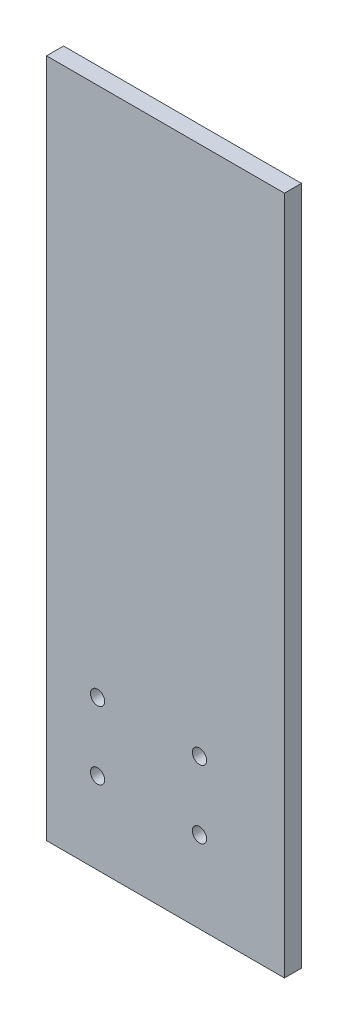
from build123d import *

# Parameters (mm, degrees)
SKETCH_1_W          = 100
SKETCH_1_H          = 200
EXTRUDE_1_DEPTH     = 5
CUT_EXTRUDE_2_DEPTH = 0.001
M4X0_7_HELICOIL_1_D = 4.2
SKETCH_13_W         = 10
SKETCH_13_H         = 200
CUT_EXTRUDE_4_DEPTH = 10
SKETCH_14_W         = 10
SKETCH_14_H         = 200
CUT_EXTRUDE_5_DEPTH = 10


with BuildPart() as part:
    # 스케치1 → 보스-돌출1 (new body)
    with BuildSketch(Plane.XY):
        Rectangle(SKETCH_1_W, SKETCH_1_H)
    extrude(amount=EXTRUDE_1_DEPTH)

    # 스케치3 → 컷-돌출2 (cut)
    # profile 1 of 5: a face of its own
    with BuildSketch(Plane(origin=(0, 0, 0), x_dir=(-1, 0, 0), z_dir=(0, 0, -1))):
        with BuildLine():
            Line((1.435897436, 3.568709936), (1.435897436, 3.241987179))
            add(Edge.make_bspline(
                [(1.435897436, 3.241987179), (1.406158657, 3.253938052), (1.349713836, 3.276621056), (1.26647346, 3.301285681), (1.189944626, 3.317221421), (1.140790736, 3.319457366), (1.117588141, 3.320512821)],
                knots=[0, 0, 0, 0, 1.16548392, 2.212112691, 3.15604595, 4, 4, 4, 4], degree=3))
            add(Edge.make_bspline(
                [(1.117588141, 3.320512821), (1.101914377, 3.31986148), (1.071575198, 3.318600703), (1.027971871, 3.312172427), (0.988682661, 3.299069626), (0.953777041, 3.28204035), (0.924826581, 3.260686166), (0.900040357, 3.239230902), (0.882073827, 3.215045722), (0.872318879, 3.192525311), (0.866368878, 3.171674318), (0.86457875, 3.150320052), (0.860193836, 3.124095966), (0.858971029, 3.091932248), (0.856183661, 3.054829537), (0.856430302, 3.012002641), (0.854146379, 2.964125498), (0.854488293, 2.930224949), (0.854667468, 2.912459936)],
                knots=[0, 0, 0, 0, 1.311993654, 2.539582093, 3.670788641, 4.763509788, 5.772417512, 6.671800701, 7.496729179, 8.266799162, 8.712543678, 9.304149002, 10.05334463, 10.934920737, 11.99209668, 13.165090968, 14.514413552, 16, 16, 16, 16], degree=3))
            Line((0.854667468, 2.912459936), (0.854667468, 2.557692308))
            Line((0.854667468, 2.557692308), (1.391025641, 2.557692308))
            Line((1.391025641, 2.557692308), (1.391025641, 2.243589744))
            Line((1.391025641, 2.243589744), (0.853966346, 2.243589744))
            Line((0.853966346, 2.243589744), (0.852564103, 0))
            Line((0.852564103, 0), (0.538461538, 0))
            Line((0.538461538, 0), (0.538461538, 2.243589744))
            Line((0.538461538, 2.243589744), (0.179487179, 2.243589744))
            Line((0.179487179, 2.243589744), (0.179487179, 2.557692308))
            Line((0.179487179, 2.557692308), (0.538461538, 2.557692308))
            Line((0.538461538, 2.557692308), (0.538461538, 2.966446314))
            add(Edge.make_bspline(
                [(0.538461538, 2.966446314), (0.538486753, 2.989121894), (0.538535124, 3.032622798), (0.541922975, 3.095232239), (0.544818696, 3.153055703), (0.550586323, 3.205644336), (0.557248029, 3.253490479), (0.566784189, 3.29588336), (0.57579556, 3.333965119), (0.592144152, 3.377067776), (0.616566371, 3.4259178), (0.656096568, 3.4775417), (0.703489575, 3.523846647), (0.760097899, 3.562854), (0.823813434, 3.595269478), (0.894694612, 3.618511331), (0.97196981, 3.631651776), (1.02545728, 3.633605985), (1.053084936, 3.634615385)],
                knots=[0, 0, 0, 0, 1.116398763, 2.141702935, 3.087165306, 3.966655413, 4.746276475, 5.464069668, 6.106083417, 6.67047701, 7.730773247, 8.782666744, 9.856985883, 10.980834087, 12.154321827, 13.366232824, 14.639591414, 16, 16, 16, 16], degree=3))
            add(Edge.make_bspline(
                [(1.053084936, 3.634615385), (1.081161694, 3.633658004), (1.140107358, 3.631648034), (1.232303961, 3.619214627), (1.331900478, 3.597743597), (1.400236399, 3.578665712), (1.435897436, 3.568709936)],
                knots=[0, 0, 0, 0, 0.864728408, 1.815451418, 2.859995356, 4, 4, 4, 4], degree=3))
        make_face()
    # profile 2 of 5: a face of its own
    with BuildSketch(Plane(origin=(0, 0, 0), x_dir=(-1, 0, 0), z_dir=(0, 0, -1))):
        with BuildLine():
            Line((1.794871795, 2.557692308), (2.108974359, 2.557692308))
            Line((2.108974359, 2.557692308), (2.108974359, 2.181189904))
            add(Edge.make_bspline(
                [(2.108974359, 2.181189904), (2.132163118, 2.216245732), (2.176511439, 2.283289731), (2.250224368, 2.371959032), (2.325727699, 2.445374079), (2.403382887, 2.503877598), (2.483760987, 2.547690717), (2.565097938, 2.579783752), (2.648673408, 2.598761067), (2.704835332, 2.601294726), (2.732972756, 2.602564103)],
                knots=[0, 0, 0, 0, 1.2804753, 2.448899062, 3.506932113, 4.484331642, 5.4025378, 6.288909075, 7.142734305, 8, 8, 8, 8], degree=3))
            add(Edge.make_bspline(
                [(2.732972756, 2.602564103), (2.754799083, 2.601373576), (2.799708168, 2.59892399), (2.867690758, 2.581713165), (2.93773421, 2.554235143), (2.982876597, 2.52839492), (3.006410256, 2.514923878)],
                knots=[0, 0, 0, 0, 0.901110191, 1.854092781, 2.881294221, 4, 4, 4, 4], degree=3))
            Line((3.006410256, 2.514923878), (2.833934295, 2.242888622))
            add(Edge.make_bspline(
                [(2.833934295, 2.242888622), (2.818825274, 2.249628888), (2.790145459, 2.262423203), (2.748190893, 2.277565213), (2.709509556, 2.286481129), (2.684865998, 2.287831847), (2.673377404, 2.288461538)],
                knots=[0, 0, 0, 0, 1.180555205, 2.24091978, 3.179933427, 4, 4, 4, 4], degree=3))
            add(Edge.make_bspline(
                [(2.673377404, 2.288461538), (2.64817167, 2.286781501), (2.59675928, 2.283354712), (2.521274781, 2.256415904), (2.448027575, 2.212890664), (2.389855913, 2.164619552), (2.34481366, 2.118071755), (2.312673435, 2.077423352), (2.283190688, 2.031844721), (2.255020467, 1.982115037), (2.229354173, 1.927385191), (2.205399504, 1.868201977), (2.183740641, 1.804496849), (2.171390397, 1.760114328), (2.165064103, 1.737379808)],
                knots=[0, 0, 0, 0, 1.125678352, 2.296057538, 3.5422874, 4.923748041, 5.663163013, 6.437101912, 7.23742474, 8.08941207, 8.991984279, 9.93940061, 10.944477711, 12, 12, 12, 12], degree=3))
            add(Edge.make_bspline(
                [(2.165064103, 1.737379808), (2.160331709, 1.717102634), (2.149849818, 1.672190235), (2.13965828, 1.596841711), (2.129588762, 1.507818052), (2.122492143, 1.404871459), (2.115914101, 1.288259015), (2.112204019, 1.15780307), (2.109100878, 1.013369718), (2.109017812, 0.912395365), (2.108974359, 0.859575321)],
                knots=[0, 0, 0, 0, 0.566838948, 1.255505196, 2.06880316, 3.007127437, 4.065329342, 5.249902469, 6.561414163, 8, 8, 8, 8], degree=3))
            Line((2.108974359, 0.859575321), (2.108974359, 0))
            Line((2.108974359, 0), (1.794871795, 0))
            Line((1.794871795, 0), (1.794871795, 2.557692308))
        make_face()
    # profile 3 of 5: a face of its own
    with BuildSketch(Plane(origin=(0, 0, 0), x_dir=(-1, 0, 0), z_dir=(0, 0, -1))):
        with BuildLine():
            add(Edge.make_bspline(
                [(4.555889423, 2.602564103), (4.603880696, 2.601542211), (4.697979853, 2.599538533), (4.835787739, 2.578123567), (4.967332875, 2.545376203), (5.093119067, 2.500104641), (5.211535363, 2.43942269), (5.324306607, 2.367013399), (5.431123616, 2.281230805), (5.495146645, 2.214872737), (5.527644231, 2.181189904)],
                knots=[0, 0, 0, 0, 1.054011418, 2.066658804, 3.057071809, 4.030435133, 4.997543892, 5.974964718, 6.972108034, 8, 8, 8, 8], degree=3))
            add(Edge.make_bspline(
                [(5.527644231, 2.181189904), (5.555626185, 2.148975918), (5.611048565, 2.085171376), (5.682114284, 1.981715763), (5.743335844, 1.874575662), (5.792398805, 1.762328336), (5.831083829, 1.645953664), (5.858549525, 1.525051653), (5.87488646, 1.399889306), (5.877089427, 1.314885468), (5.878205128, 1.271834936)],
                knots=[0, 0, 0, 0, 1.025258237, 2.030674902, 3.01204498, 3.988269485, 4.97094183, 5.956517959, 6.965070386, 8, 8, 8, 8], degree=3))
            add(Edge.make_bspline(
                [(5.878205128, 1.271834936), (5.877223791, 1.228534878), (5.875284623, 1.142971945), (5.856941006, 1.016952579), (5.82840992, 0.894757756), (5.787578082, 0.776899063), (5.735219973, 0.663016235), (5.671329285, 0.553606686), (5.595457668, 0.448454553), (5.509453671, 0.348452714), (5.414401795, 0.2562865), (5.311285647, 0.17595823), (5.202131613, 0.107136706), (5.08548826, 0.05170029), (4.962420773, 0.00799059), (4.832663705, -0.022709427), (4.696418635, -0.04127111), (4.603391413, -0.043654684), (4.555889423, -0.044871795)],
                knots=[0, 0, 0, 0, 0.998656419, 1.973391657, 2.932242238, 3.890759089, 4.846373663, 5.82037756, 6.809684879, 7.83454468, 8.860553229, 9.859544525, 10.845671541, 11.83227036, 12.833544569, 13.85385346, 14.904124723, 16, 16, 16, 16], degree=3))
            add(Edge.make_bspline(
                [(4.555889423, -0.044871795), (4.508154704, -0.043650599), (4.414663844, -0.041258824), (4.277937862, -0.022781541), (4.147948243, 0.007976441), (4.024719644, 0.051843934), (3.907574798, 0.107138478), (3.797788301, 0.175750167), (3.694588385, 0.256310322), (3.599516401, 0.348446259), (3.513517795, 0.448456216), (3.437644787, 0.553606254), (3.373754461, 0.663016348), (3.321396257, 0.776899033), (3.280564444, 0.894757764), (3.252033351, 1.016952577), (3.233689737, 1.142971945), (3.231750568, 1.228534878), (3.230769231, 1.271834936)],
                knots=[0, 0, 0, 0, 1.099876186, 2.154163076, 3.173186993, 4.173200201, 5.163417411, 6.152872554, 7.150605724, 8.17532212, 9.198891216, 10.186952605, 11.159729845, 12.11414092, 13.071450619, 14.029093627, 15.002601286, 16, 16, 16, 16], degree=3))
            add(Edge.make_bspline(
                [(3.230769231, 1.271834936), (3.231892541, 1.314651482), (3.234116503, 1.399420884), (3.250437012, 1.524347945), (3.277795568, 1.645045334), (3.316526965, 1.76097081), (3.366042155, 1.872726246), (3.426403443, 1.980131077), (3.498194076, 2.083118877), (3.553396027, 2.146840957), (3.581330128, 2.179086538)],
                knots=[0, 0, 0, 0, 1.031353054, 2.041901799, 3.029428768, 4.008703097, 4.981709435, 5.96992636, 6.972712378, 8, 8, 8, 8], degree=3))
            add(Edge.make_bspline(
                [(3.581330128, 2.179086538), (3.613778719, 2.213061478), (3.677594583, 2.279879174), (3.784943311, 2.365411698), (3.897437132, 2.439327772), (4.017162058, 2.498803987), (4.142844916, 2.545642505), (4.275064159, 2.57820802), (4.413339674, 2.599461375), (4.507899295, 2.601519553), (4.555889423, 2.602564103)],
                knots=[0, 0, 0, 0, 1.027980169, 2.021703884, 2.998553061, 3.971491411, 4.943284454, 5.930300938, 6.949603206, 8, 8, 8, 8], degree=3))
        make_face()
        with BuildLine():
            add(Edge.make_bspline(
                [(4.554487179, 2.288461538), (4.520549568, 2.287496947), (4.453550439, 2.285592664), (4.354930855, 2.27110876), (4.259990701, 2.248161255), (4.168549857, 2.215557199), (4.080916684, 2.1734583), (3.997007282, 2.12174994), (3.916574842, 2.061116984), (3.841192779, 1.991654312), (3.772010466, 1.915775317), (3.71153249, 1.834926959), (3.660107384, 1.750420612), (3.617267225, 1.662168401), (3.585360036, 1.569275987), (3.562187014, 1.472795356), (3.547716774, 1.37252994), (3.545830395, 1.304368921), (3.544871795, 1.269731571)],
                knots=[0, 0, 0, 0, 1.021534396, 2.016698045, 2.994645724, 3.958388632, 4.93408049, 5.916473867, 6.921342795, 7.962252576, 8.998418191, 10.008913653, 10.997312074, 11.973003931, 12.956656626, 13.948281152, 14.957379055, 16, 16, 16, 16], degree=3))
            add(Edge.make_bspline(
                [(3.544871795, 1.269731571), (3.546478619, 1.224979543), (3.549667863, 1.136155138), (3.575603099, 1.005344015), (3.618989379, 0.879762163), (3.677576659, 0.760145777), (3.750982878, 0.649473499), (3.837469944, 0.550802015), (3.936109645, 0.465616203), (4.045726145, 0.394935358), (4.164080463, 0.338775602), (4.289336784, 0.298976626), (4.419977478, 0.273104934), (4.509258209, 0.270533459), (4.554487179, 0.269230769)],
                knots=[0, 0, 0, 0, 1.016792936, 2.018143844, 3.017858371, 4.030088057, 5.03801393, 6.028138512, 7.003788237, 7.991172063, 8.984598303, 9.972568034, 10.972917682, 12, 12, 12, 12], degree=3))
            add(Edge.make_bspline(
                [(4.554487179, 0.269230769), (4.599713548, 0.270541049), (4.688989144, 0.273127506), (4.819448321, 0.298846326), (4.944362293, 0.338949987), (5.062593681, 0.394872197), (5.172160284, 0.465884611), (5.271509405, 0.550320988), (5.357258017, 0.64973484), (5.430591621, 0.760292369), (5.490138364, 0.879576721), (5.533321566, 1.005367193), (5.559319152, 1.136149235), (5.562499981, 1.224977566), (5.564102564, 1.269731571)],
                knots=[0, 0, 0, 0, 1.02726834, 2.027799167, 3.010890988, 4.004497153, 4.992059811, 5.971914811, 6.958719428, 7.966827853, 8.981595046, 9.981490638, 10.983022906, 12, 12, 12, 12], degree=3))
            add(Edge.make_bspline(
                [(5.564102564, 1.269731571), (5.563144294, 1.304369128), (5.561258565, 1.372530554), (5.546783601, 1.472793007), (5.523628061, 1.569284604), (5.491656444, 1.662136607), (5.44900243, 1.750649112), (5.396585637, 1.834678839), (5.336354611, 1.916055385), (5.26633749, 1.991409026), (5.191034113, 2.061144062), (5.110569074, 2.121773452), (5.026784096, 2.173231047), (4.939405513, 2.215917288), (4.847952945, 2.247864628), (4.753145816, 2.271241259), (4.654947006, 2.285531456), (4.588187963, 2.287478598), (4.554487179, 2.288461538)],
                knots=[0, 0, 0, 0, 1.042956736, 2.052379634, 3.044323526, 4.02829302, 5.004299113, 5.996692471, 7.007513377, 8.048758398, 9.090003419, 10.095195979, 11.07790575, 12.047570684, 13.018257071, 13.989683339, 14.985167495, 16, 16, 16, 16], degree=3))
        make_face(mode=Mode.SUBTRACT)
    # profile 4 of 5: a face of its own
    with BuildSketch(Plane(origin=(0, 0, 0), x_dir=(-1, 0, 0), z_dir=(0, 0, -1))):
        with BuildLine():
            Line((6.506410256, 2.557692308), (6.820512821, 2.557692308))
            Line((6.820512821, 2.557692308), (6.820512821, 2.096354167))
            add(Edge.make_bspline(
                [(6.820512821, 2.096354167), (6.854050456, 2.13819689), (6.919131407, 2.219394153), (7.02751574, 2.326114728), (7.14205964, 2.414059953), (7.262061644, 2.484163747), (7.387684654, 2.537010373), (7.518162924, 2.575176304), (7.65427763, 2.598061132), (7.746842067, 2.601051363), (7.793669872, 2.602564103)],
                knots=[0, 0, 0, 0, 1.12780773, 2.188550248, 3.19190651, 4.159438251, 5.104880172, 6.052711206, 7.014878035, 8, 8, 8, 8], degree=3))
            add(Edge.make_bspline(
                [(7.793669872, 2.602564103), (7.841000506, 2.600818907), (7.933637974, 2.597403139), (8.068516035, 2.570386448), (8.194489429, 2.524241192), (8.311108985, 2.461029122), (8.416236198, 2.382422649), (8.508561049, 2.290844867), (8.584924297, 2.185508784), (8.63612166, 2.087785627), (8.669847307, 2.001096833), (8.691079645, 1.926850083), (8.709110626, 1.844131932), (8.724742374, 1.753192343), (8.735319486, 1.653394153), (8.743661778, 1.545146461), (8.749640472, 1.42848433), (8.749877679, 1.347797703), (8.75, 1.306189904)],
                knots=[0, 0, 0, 0, 1.235846778, 2.418850247, 3.575807741, 4.728682307, 5.871620074, 6.994088408, 8.11269785, 9.256955736, 9.865816715, 10.540099792, 11.271859618, 12.076849838, 12.949306005, 13.892391288, 14.913166135, 16, 16, 16, 16], degree=3))
            Line((8.75, 1.306189904), (8.75, 0))
            Line((8.75, 0), (8.435897436, 0))
            Line((8.435897436, 0), (8.435897436, 1.203125))
            add(Edge.make_bspline(
                [(8.435897436, 1.203125), (8.435704228, 1.237947445), (8.435334654, 1.304556856), (8.434169007, 1.399925879), (8.431359201, 1.486412457), (8.427410888, 1.563809825), (8.421631857, 1.632043661), (8.415609226, 1.691252938), (8.408244249, 1.74136248), (8.401681336, 1.771527563), (8.398737981, 1.78505609)],
                knots=[0, 0, 0, 0, 1.430800155, 2.736877192, 3.918605307, 4.986035426, 5.920637409, 6.731861385, 7.431261377, 8, 8, 8, 8], degree=3))
            add(Edge.make_bspline(
                [(8.398737981, 1.78505609), (8.388112449, 1.824767275), (8.367661589, 1.901199019), (8.317127605, 2.004873372), (8.253313425, 2.09307156), (8.175415575, 2.165248281), (8.0841865, 2.221419118), (7.979879357, 2.260393073), (7.863500716, 2.284769342), (7.781646334, 2.287196474), (7.738982372, 2.288461538)],
                knots=[0, 0, 0, 0, 1.084156227, 2.086665306, 3.027808233, 3.945421172, 4.874247719, 5.839848303, 6.874090471, 8, 8, 8, 8], degree=3))
            add(Edge.make_bspline(
                [(7.738982372, 2.288461538), (7.713714688, 2.287985534), (7.663710595, 2.287043533), (7.589560623, 2.277592235), (7.51763645, 2.262133779), (7.447216241, 2.241265142), (7.379708447, 2.212602873), (7.312944156, 2.180073502), (7.249437392, 2.13952529), (7.187833995, 2.094334669), (7.130521187, 2.044255462), (7.077192849, 1.991410952), (7.029654829, 1.935135348), (6.986586153, 1.8763354), (6.94940789, 1.814203562), (6.916954802, 1.749339256), (6.889419107, 1.681657107), (6.875736415, 1.634682046), (6.868890224, 1.611177885)],
                knots=[0, 0, 0, 0, 1.023777757, 2.026029729, 3.023749952, 4.003683103, 4.997618607, 5.993177895, 7.010360494, 8.046726602, 9.087585522, 10.09234134, 11.086953743, 12.070360549, 13.043493632, 14.017870808, 15.008233677, 16, 16, 16, 16], degree=3))
            add(Edge.make_bspline(
                [(6.868890224, 1.611177885), (6.864950576, 1.593922682), (6.856374167, 1.556359007), (6.847110987, 1.494714588), (6.838703412, 1.423404613), (6.831666453, 1.342512296), (6.827361037, 1.251754421), (6.82266664, 1.151518583), (6.820957579, 1.041405094), (6.820665225, 0.964743402), (6.820512821, 0.924779647)],
                knots=[0, 0, 0, 0, 0.615963638, 1.340920617, 2.168419149, 3.115676021, 4.16674242, 5.331190069, 6.6087489, 8, 8, 8, 8], degree=3))
            Line((6.820512821, 0.924779647), (6.820512821, 0))
            Line((6.820512821, 0), (6.506410256, 0))
            Line((6.506410256, 0), (6.506410256, 2.557692308))
        make_face()
    # profile 5 of 5: a face of its own
    with BuildSketch(Plane(origin=(0, 0, 0), x_dir=(-1, 0, 0), z_dir=(0, 0, -1))):
        Polygon((9.782051282, 3.58974359), (10.096153846, 3.58974359), (10.096153846, 2.557692308), (10.544871795, 2.557692308), (10.544871795, 2.243589744), (10.096153846, 2.243589744), (10.096153846, 0), (9.782051282, 0), (9.782051282, 2.243589744), (9.333333333, 2.243589744), (9.333333333, 2.557692308), (9.782051282, 2.557692308), align=None)
    extrude(amount=-CUT_EXTRUDE_2_DEPTH, mode=Mode.SUBTRACT)

    # M4x0.7 Helicoil용 탭 구멍1 (through all)
    with Locations(Plane(origin=(0, 0, -5), x_dir=(-1, 0, 0), z_dir=(0, 0, -1))):
        with Locations((-5, -76), (25, -76), (-5, -56), (25, -56)):
            Hole(M4X0_7_HELICOIL_1_D / 2)

    # 스케치13 → 컷-돌출4 (cut)
    with BuildSketch(Plane.XY.offset(5)):
        with Locations((45, 0)):
            Rectangle(SKETCH_13_W, SKETCH_13_H)
        with Locations((-45, 0)):
            Rectangle(SKETCH_13_W, SKETCH_13_H)
    extrude(amount=-CUT_EXTRUDE_4_DEPTH, mode=Mode.SUBTRACT)

    # 스케치14 → 컷-돌출5 (cut)
    with BuildSketch(Plane.XY.offset(5)):
        with Locations((35, 0)):
            Rectangle(SKETCH_14_W, SKETCH_14_H)
    extrude(amount=-CUT_EXTRUDE_5_DEPTH, mode=Mode.SUBTRACT)


solid = part.part
